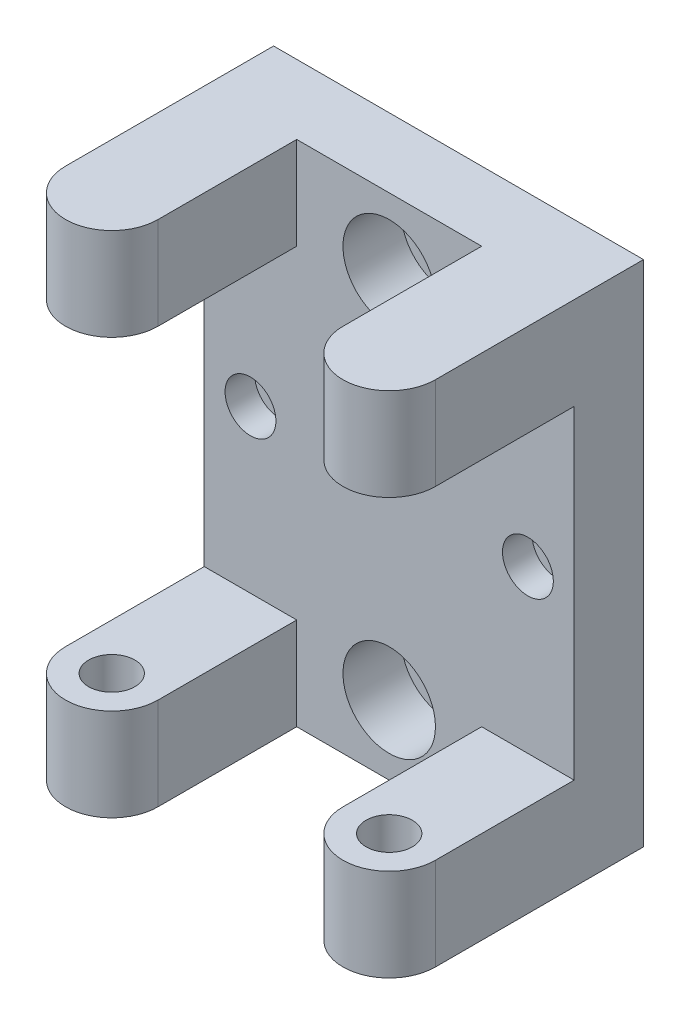
from build123d import *

# Parameters (mm, degrees)
SKETCH_1_W                    = 80
SKETCH_1_H                    = 110
EXTRUDE_1_DEPTH               = 15
HOLE_WIZARD_M12_1_D           = 13.5
HOLE_WIZARD_M12_1_CBORE_D     = 20
HOLE_WIZARD_M12_1_CBORE_DEPTH = 12.6
EXTRUDE_2_DEPTH               = 20
SKETCH_5_R                    = 5
CUT_EXTRUDE_1_DEPTH           = 10
HOLE_WIZARD_M6_1_D            = 6.6
HOLE_WIZARD_M6_1_CBORE_D      = 11
HOLE_WIZARD_M6_1_CBORE_DEPTH  = 6.4


with BuildPart() as part:
    # 草图1 → 凸台-拉伸1 (new body)
    with BuildSketch(Plane.XY):
        Rectangle(SKETCH_1_W, SKETCH_1_H)
    extrude(amount=EXTRUDE_1_DEPTH)

    # M12 六角凹头螺钉的柱形沉头孔1 (through all)
    with Locations(Plane.XY.offset(15)):
        with Locations((0, 40), (0, -40)):
            CounterBoreHole(HOLE_WIZARD_M12_1_D / 2, HOLE_WIZARD_M12_1_CBORE_D / 2, HOLE_WIZARD_M12_1_CBORE_DEPTH)

    # 草图4 → 凸台-拉伸2 (add)
    with BuildSketch(Plane.XZ.offset(55)):
        with BuildLine():
            Line((-40, 15), (-40, 45))
            ThreePointArc((-40, 45), (-30, 55), (-20, 45))
            Line((-20, 45), (-20, 15))
            Line((-20, 15), (-40, 15))
        make_face()
        with BuildLine():
            Line((40, 15), (40, 45))
            ThreePointArc((40, 45), (30, 55), (20, 45))
            Line((20, 45), (20, 15))
            Line((20, 15), (40, 15))
        make_face()
    extrude_2 = extrude(amount=-EXTRUDE_2_DEPTH)

    # 镜向1: 凸台-拉伸2 across plane
    add(extrude_2.mirror(Plane(origin=(0, 0, 0), x_dir=(0, 0, 1), z_dir=(0, -1, 0))))

    # 草图5 → 切除-拉伸1 (cut)
    with BuildSketch(Plane(origin=(0, -35, 0), x_dir=(1, 0, 0), z_dir=(0, 1, 0))):
        with Locations(Location((30, -45, 0), (0, 0, 270))):
            Circle(SKETCH_5_R)
        with Locations(Location((-30, -45, 0), (0, 0, 270))):
            Circle(SKETCH_5_R)
    cut_extrude_1 = extrude(amount=-CUT_EXTRUDE_1_DEPTH, mode=Mode.SUBTRACT)

    # 镜向2: 切除-拉伸1 across plane
    add(cut_extrude_1.mirror(Plane(origin=(0, 0, 0), x_dir=(0, 0, 1), z_dir=(0, -1, 0))), mode=Mode.SUBTRACT)

    # M6 六角凹头螺钉的柱形沉头孔1 (through all)
    with Locations(Plane.XY.offset(15)):
        with Locations((-30, 0), (30, 0)):
            CounterBoreHole(HOLE_WIZARD_M6_1_D / 2, HOLE_WIZARD_M6_1_CBORE_D / 2, HOLE_WIZARD_M6_1_CBORE_DEPTH)


solid = part.part
